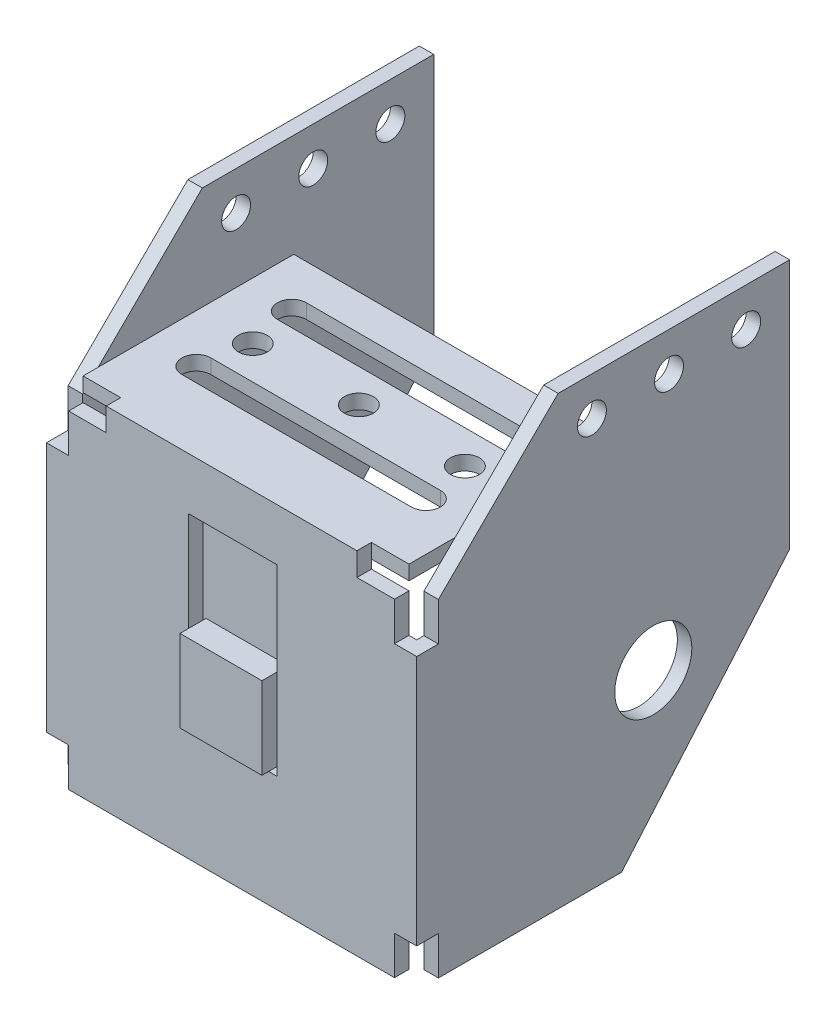
from build123d import *

# Parameters (mm, degrees)
BOSS_EXTRUDE1_DEPTH = 1.5
SKETCH3_W           = 9.15
SKETCH3_H           = 19
CUT_EXTRUDE1_DEPTH  = 1.5
SKETCH2_W           = 33.8
SKETCH2_H           = 1.5
BOSS_EXTRUDE2_DEPTH = 21.85
SKETCH4_R           = 1.5
CUT_EXTRUDE2_DEPTH  = 1.5
BOSS_EXTRUDE3_DEPTH = 1.5
CUT_EXTRUDE4_REACH  = 72.71
SKETCH6_R           = 1.5
SKETCH6_3_R         = 4
CUT_EXTRUDE5_DEPTH  = 1.5
SKETCH8_W           = 24
SKETCH8_H           = 23
BOSS_EXTRUDE5_DEPTH = 1.5
SKETCH9_W           = 8.5
SKETCH9_H           = 8.5
BOSS_EXTRUDE6_DEPTH = 2.7


with BuildPart() as part:
    # Sketch1 → Boss-Extrude1 (new body)
    with BuildSketch(Plane.XY):
        Polygon((-16.9, 0), (16.9, 0), (16.9, 4), (19.2, 4), (19.2, 30), (16.9, 30), (16.9, 34), (13, 34), (13, 36.4), (-13, 36.4), (-13, 34), (-16.9, 34), (-16.9, 30), (-19.2, 30), (-19.2, 4), (-16.9, 4), align=None)
    extrude(amount=BOSS_EXTRUDE1_DEPTH)

    # Sketch3 → Cut-Extrude1 (cut)
    with BuildSketch(Plane.XY.offset(1.5)):
        with Locations((0.125, 21.5)):
            Rectangle(SKETCH3_W, SKETCH3_H)
    extrude(amount=-CUT_EXTRUDE1_DEPTH, mode=Mode.SUBTRACT)

    # Sketch2 → Boss-Extrude2 (add)
    with BuildSketch(Plane(origin=(0, 0, 0), x_dir=(-1, 0, 0), z_dir=(0, 0, -1))):
        with Locations((0, 35.65)):
            Rectangle(SKETCH2_W, SKETCH2_H)
    extrude(amount=BOSS_EXTRUDE2_DEPTH)

    # Sketch4 → Cut-Extrude2 (cut)
    with BuildSketch(Plane(origin=(0, 36.4, 0), x_dir=(1, 0, 0), z_dir=(0, 1, 0))):
        with Locations(Location((-11, 11.7, 0), (0, 0, 270))):
            Circle(SKETCH4_R)
        with Locations(Location((0, 11.7, 0), (0, 0, 270))):
            Circle(SKETCH4_R)
        with Locations(Location((11, 11.7, 0), (0, 0, 270))):
            Circle(SKETCH4_R)
        with BuildLine():
            Line((-11.9, 8.25), (11.9, 8.25))
            ThreePointArc((11.9, 8.25), (13.4, 6.75), (11.9, 5.25))
            Line((11.9, 5.25), (-11.9, 5.25))
            ThreePointArc((-11.9, 5.25), (-13.4, 6.75), (-11.9, 8.25))
        make_face()
        with BuildLine():
            Line((-11.9, 18.15), (11.9, 18.15))
            ThreePointArc((11.9, 18.15), (13.4, 16.65), (11.9, 15.15))
            Line((11.9, 15.15), (-11.9, 15.15))
            ThreePointArc((-11.9, 15.15), (-13.4, 16.65), (-11.9, 18.15))
        make_face()
    extrude(amount=-CUT_EXTRUDE2_DEPTH, mode=Mode.SUBTRACT)

    # Sketch5 → Boss-Extrude3 (add)
    with BuildSketch(Plane(origin=(19.2, 0, 0), x_dir=(0, 0, -1), z_dir=(1, 0, 0))):
        Polygon((0, 30), (0.75, 30), (0.75, 34), (13.17, 46.3), (37.17, 46.3), (37.17, 20.3), (19.75, 0), (0.75, 0), (0.75, 4), (0, 4), (-1.5, 4), (-1.5, 30), align=None)
    boss_extrude3 = extrude(amount=-BOSS_EXTRUDE3_DEPTH)

    # Mirror1: Boss-Extrude3 across plane
    add(boss_extrude3.mirror(Plane(origin=(0, 0, 0), x_dir=(0, 0, 1), z_dir=(1, 0, 0))))

    # Cut-Extrude4: up to this face of the body (flat: up to its plane)
    cut_extrude4_end = Plane(part.part.faces().sort_by_distance((-19.2, 23.875362989, -17.45186466))[0])
    # Sketch6 → Cut-Extrude4 (cut, up to the picked face)
    with BuildSketch(Plane(origin=(19.2, 0, 0), x_dir=(0, 0, -1), z_dir=(1, 0, 0)), mode=Mode.PRIVATE) as cut_extrude4_sk1:
        with Locations((16.67, 42.3)):
            Circle(SKETCH6_R)
    cut_extrude4_tool1 = split(extrude(cut_extrude4_sk1.sketch, amount=-CUT_EXTRUDE4_REACH, mode=Mode.PRIVATE), bisect_by=cut_extrude4_end, keep=Keep.BOTH, mode=Mode.PRIVATE)
    # Sketch6 → Cut-Extrude4 (cut, up to the picked face)
    with BuildSketch(Plane(origin=(19.2, 0, 0), x_dir=(0, 0, -1), z_dir=(1, 0, 0)), mode=Mode.PRIVATE) as cut_extrude4_sk2:
        with Locations((24.67, 42.3)):
            Circle(SKETCH6_R)
    cut_extrude4_tool2 = split(extrude(cut_extrude4_sk2.sketch, amount=-CUT_EXTRUDE4_REACH, mode=Mode.PRIVATE), bisect_by=cut_extrude4_end, keep=Keep.BOTH, mode=Mode.PRIVATE)
    # Sketch6 → Cut-Extrude4 (cut, up to the picked face)
    with BuildSketch(Plane(origin=(19.2, 0, 0), x_dir=(0, 0, -1), z_dir=(1, 0, 0)), mode=Mode.PRIVATE) as cut_extrude4_sk3:
        with Locations((32.67, 42.3)):
            Circle(SKETCH6_R)
    cut_extrude4_tool3 = split(extrude(cut_extrude4_sk3.sketch, amount=-CUT_EXTRUDE4_REACH, mode=Mode.PRIVATE), bisect_by=cut_extrude4_end, keep=Keep.BOTH, mode=Mode.PRIVATE)
    add(cut_extrude4_tool1.solids().sort_by(Axis((19.2, 42.3, -16.67), (-1, 0, 0)))[0], mode=Mode.SUBTRACT)
    add(cut_extrude4_tool2.solids().sort_by(Axis((19.2, 42.3, -24.67), (-1, 0, 0)))[0], mode=Mode.SUBTRACT)
    add(cut_extrude4_tool3.solids().sort_by(Axis((19.2, 42.3, -32.67), (-1, 0, 0)))[0], mode=Mode.SUBTRACT)

    # Sketch6<3> → Cut-Extrude5 (cut)
    with BuildSketch(Plane(origin=(19.2, 0, 0), x_dir=(0, 0, -1), z_dir=(1, 0, 0))):
        with Locations((23.037930183, 16.5)):
            Circle(SKETCH6_3_R)
    extrude(amount=-CUT_EXTRUDE5_DEPTH, mode=Mode.SUBTRACT)

    # Sketch8 → Boss-Extrude5 (add)
    with BuildSketch(Plane(origin=(0, 0, 0), x_dir=(-1, 0, 0), z_dir=(0, 0, -1))):
        with Locations((-0.7, 20)):
            Rectangle(SKETCH8_W, SKETCH8_H)
    extrude(amount=BOSS_EXTRUDE5_DEPTH)

    # Sketch9 → Boss-Extrude6 (add)
    with BuildSketch(Plane.XY):
        with Locations((0.097336639, 16.75)):
            Rectangle(SKETCH9_W, SKETCH9_H)
    extrude(amount=BOSS_EXTRUDE6_DEPTH)


solid = part.part
